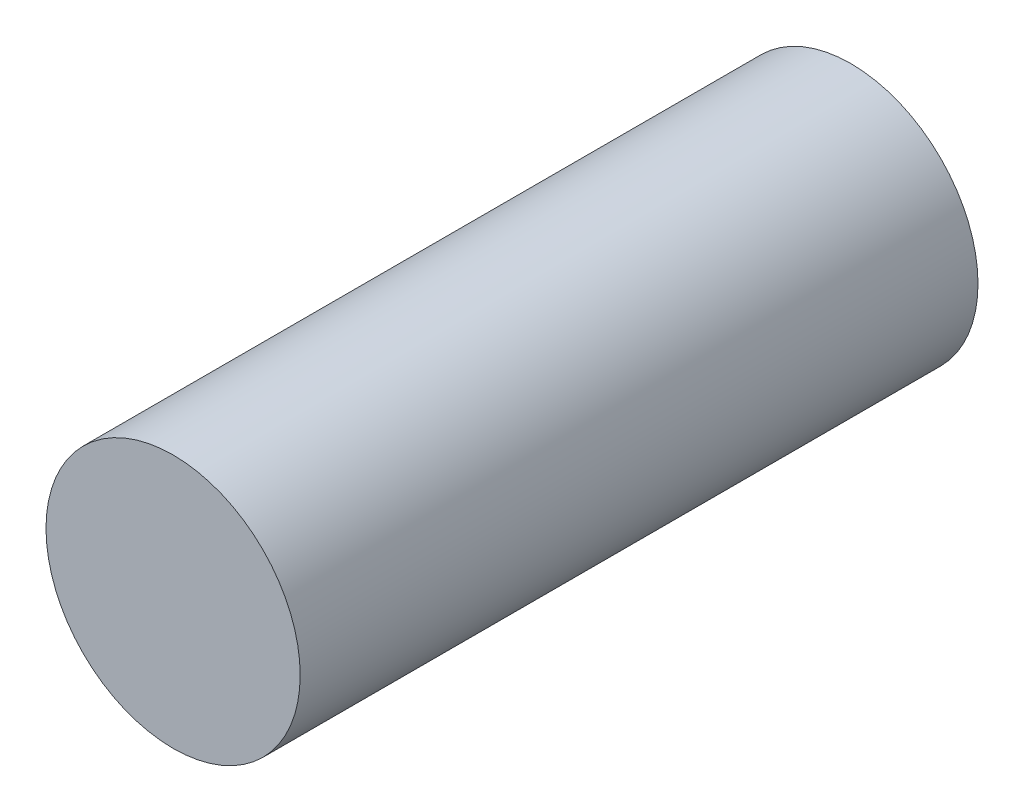
from build123d import *

# Parameters (mm, degrees)
SKETCH1_R           = 3
BOSS_EXTRUDE1_DEPTH = 16


with BuildPart() as part:
    # Sketch1 → Boss-Extrude1 (new body)
    with BuildSketch(Plane.XY):
        Circle(SKETCH1_R)
    extrude(amount=BOSS_EXTRUDE1_DEPTH)


solid = part.part
